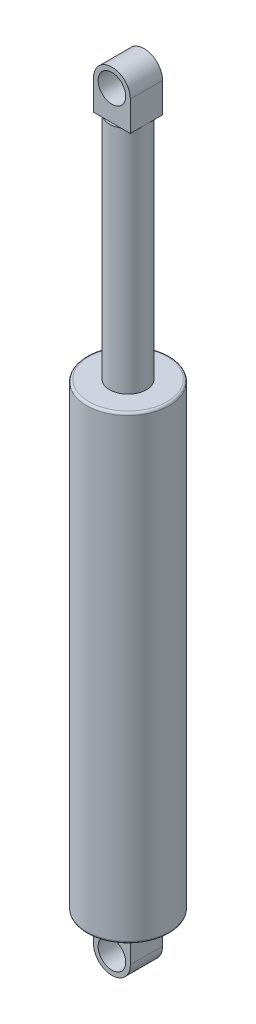
from build123d import *

# Parameters (mm, degrees)
SKETCH1_R           = 4
BOSS_EXTRUDE1_DEPTH = 50
SKETCH2_R           = 9
BOSS_EXTRUDE2_DEPTH = 100
FILLET1_R           = 0.5
BOSS_EXTRUDE4_DEPTH = 3.5
BOSS_EXTRUDE6_DEPTH = 3.5
SKETCH7_R           = 3
CUT_EXTRUDE1_DEPTH  = 112.575459307
SKETCH9_R           = 3
CUT_EXTRUDE2_DEPTH  = 112.575459307


with BuildPart() as part:
    # Sketch1 → Boss-Extrude1 (new body)
    with BuildSketch(Plane(origin=(0, 0, 0), x_dir=(1, 0, 0), z_dir=(0, 1, 0))):
        with Locations(Location((0, 0, 0), (0, 0, 270))):
            Circle(SKETCH1_R)
    extrude(amount=BOSS_EXTRUDE1_DEPTH)

    # Sketch2 → Boss-Extrude2 (add)
    with BuildSketch(Plane(origin=(0, 0, 0), x_dir=(-1, 0, 0), z_dir=(0, -1, 0))):
        with Locations(Location((0, 0, 0), (0, 0, 90))):
            Circle(SKETCH2_R)
    extrude(amount=BOSS_EXTRUDE2_DEPTH)

    # Fillet1
    fillet1_edges = [part.edges().sort_by_distance(p)[0] for p in [
        (0, 0, 9),
        (0, -100, 9),
    ]]
    fillet(fillet1_edges, radius=FILLET1_R)

    # Sketch4 → Boss-Extrude4 (add, symmetric)
    with BuildSketch(Plane.XY):
        with BuildLine():
            Line((-4, -106.507163193), (-4, -100))
            Line((-4, -100), (4, -100))
            Line((4, -100), (4, -106.507163193))
            ThreePointArc((4, -106.507163193), (0, -110.507163193), (-4, -106.507163193))
        make_face()
    extrude(amount=BOSS_EXTRUDE4_DEPTH, both=True)

    # Sketch5 → Boss-Extrude6 (add, symmetric)
    with BuildSketch(Plane.XY):
        with BuildLine():
            Line((-4, 56.5), (-4, 50))
            Line((-4, 50), (4, 50))
            Line((4, 50), (4, 56.5))
            ThreePointArc((4, 56.5), (0, 60.499999816), (-4, 56.5))
        make_face()
    extrude(amount=BOSS_EXTRUDE6_DEPTH, both=True)

    # Sketch7 → Cut-Extrude1 (cut, through all)
    with BuildSketch(Plane.XY.offset(3.5)):
        with Locations((0, 56.499999816)):
            Circle(SKETCH7_R)
    extrude(amount=-CUT_EXTRUDE1_DEPTH, mode=Mode.SUBTRACT)

    # Sketch9 → Cut-Extrude2 (cut, through all)
    with BuildSketch(Plane.XY.offset(3.5)):
        with Locations((0, -106.507163193)):
            Circle(SKETCH9_R)
    extrude(amount=-CUT_EXTRUDE2_DEPTH, mode=Mode.SUBTRACT)


solid = part.part
